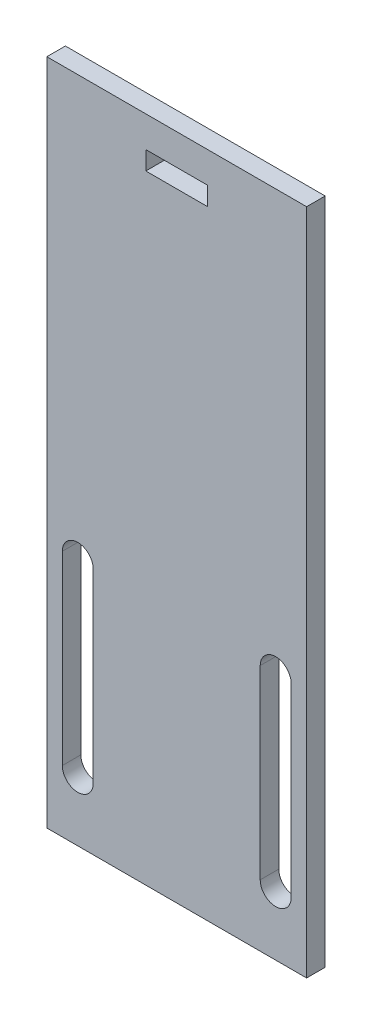
from build123d import *

# Parameters (mm, degrees)
SKETCH1_W           = 10
SKETCH1_H           = 3
BOSS_EXTRUDE1_DEPTH = 3


with BuildPart() as part:
    # Sketch1 → Boss-Extrude1 (new body)
    with BuildSketch(Plane.XY):
        Polygon((21, -78.90992989), (-21, -78.90992989), (-21, 29.09007011), (-5, 29.09007011), (21, 29.09007011), align=None)
        with BuildLine():
            Line((-13.5, -38.90992989), (-13.5, -68.90992989))
            ThreePointArc((-13.5, -68.90992989), (-16, -71.40992989), (-18.5, -68.90992989))
            Line((-18.5, -68.90992989), (-18.5, -38.90992989))
            ThreePointArc((-18.5, -38.90992989), (-16, -36.40992989), (-13.5, -38.90992989))
        make_face(mode=Mode.SUBTRACT)
        with BuildLine():
            Line((18.5, -38.90992989), (18.5, -68.90992989))
            ThreePointArc((18.5, -68.90992989), (16, -71.40992989), (13.5, -68.90992989))
            Line((13.5, -68.90992989), (13.5, -38.90992989))
            ThreePointArc((13.5, -38.90992989), (16, -36.40992989), (18.5, -38.90992989))
        make_face(mode=Mode.SUBTRACT)
        with Locations((0, 22.59007011)):
            Rectangle(SKETCH1_W, SKETCH1_H, mode=Mode.SUBTRACT)
    extrude(amount=BOSS_EXTRUDE1_DEPTH)


solid = part.part
